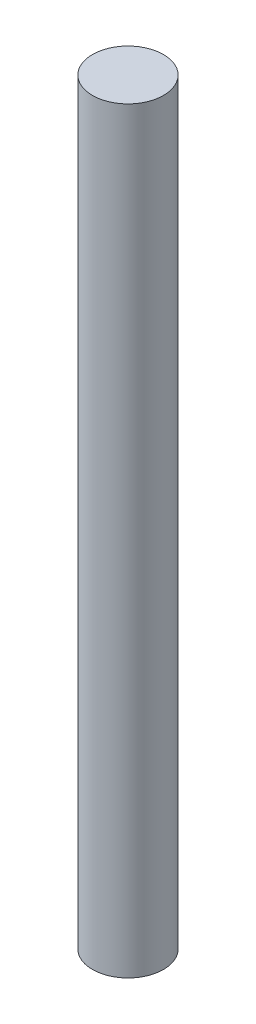
from build123d import *

# Parameters (mm, degrees)
ESQUISSE1_R        = 3
BOSS_EXTRU_1_DEPTH = 64


with BuildPart() as part:
    # Esquisse1 → Boss.-Extru.1 (new body)
    with BuildSketch(Plane(origin=(0, 0, 0), x_dir=(1, 0, 0), z_dir=(0, 1, 0))):
        with Locations(Location((0, 0, 0), (0, 0, 270))):
            Circle(ESQUISSE1_R)
    extrude(amount=BOSS_EXTRU_1_DEPTH)


solid = part.part
